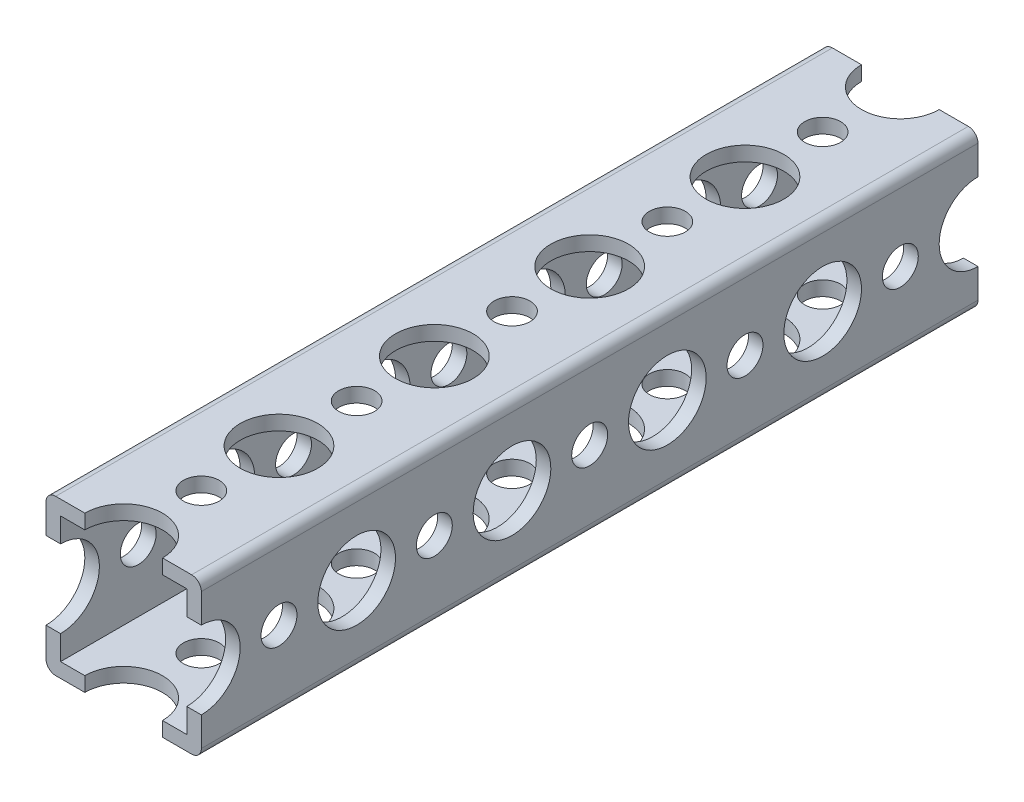
from build123d import *

# Parameters (mm, degrees)
SKETCH1_W      = 16
SKETCH1_H      = 16
EXTRUDE1_DEPTH = 80
SKETCH2_W      = 13
SKETCH2_H      = 13
EXTRUDE2_DEPTH = 84.138438763
SKETCH3_R      = 4
SKETCH3_R_2    = 1.85
EXTRUDE3_DEPTH = 84.138438763
SKETCH4_R      = 4
SKETCH4_R_2    = 1.85
EXTRUDE4_DEPTH = 84.138438763
FILLET1_R      = 1


with BuildPart() as part:
    # Sketch1 → Extrude1 (new body)
    with BuildSketch(Plane.XY):
        with Locations((8, 8)):
            Rectangle(SKETCH1_W, SKETCH1_H)
    extrude(amount=-EXTRUDE1_DEPTH)

    # Sketch2 → Extrude2 (cut, through all)
    with BuildSketch(Plane.XY):
        with Locations((8, 8)):
            Rectangle(SKETCH2_W, SKETCH2_H)
    extrude(amount=-EXTRUDE2_DEPTH, mode=Mode.SUBTRACT)

    # Sketch3 → Extrude3 (cut, through all)
    with BuildSketch(Plane(origin=(0, 16, 0), x_dir=(1, 0, 0), z_dir=(0, 1, 0))):
        with Locations(Location((8, 64, 0), (0, 0, 270))):
            Circle(SKETCH3_R)
        with Locations(Location((8, 32, 0), (0, 0, 270))):
            Circle(SKETCH3_R)
        with Locations((8, 0)):
            Circle(SKETCH3_R)
        with Locations((8, 96)):
            Circle(SKETCH3_R)
        with Locations((8, 128)):
            Circle(SKETCH3_R)
        with Locations((8, 160)):
            Circle(SKETCH3_R)
        with Locations((8, 192)):
            Circle(SKETCH3_R)
        with Locations((8, 224)):
            Circle(SKETCH3_R)
        with Locations((8, 256)):
            Circle(SKETCH3_R)
        with Locations(Location((8, 48, 0), (0, 0, 270))):
            Circle(SKETCH3_R)
        with Locations(Location((8, 56, 0), (0, 0, 270))):
            Circle(SKETCH3_R_2)
        with Locations(Location((8, 40, 0), (0, 0, 270))):
            Circle(SKETCH3_R_2)
        with Locations((8, 80)):
            Circle(SKETCH3_R)
        with Locations((8, 88)):
            Circle(SKETCH3_R_2)
        with Locations(Location((8, 72, 0), (0, 0, 270))):
            Circle(SKETCH3_R_2)
        with Locations(Location((8, 16, 0), (0, 0, 270))):
            Circle(SKETCH3_R)
        with Locations(Location((8, 24, 0), (0, 0, 270))):
            Circle(SKETCH3_R_2)
        with Locations(Location((8, 8, 0), (0, 0, 270))):
            Circle(SKETCH3_R_2)
        with Locations((8, 112)):
            Circle(SKETCH3_R)
        with Locations((8, 120)):
            Circle(SKETCH3_R_2)
        with Locations((8, 104)):
            Circle(SKETCH3_R_2)
        with Locations((8, 144)):
            Circle(SKETCH3_R)
        with Locations((8, 152)):
            Circle(SKETCH3_R_2)
        with Locations((8, 136)):
            Circle(SKETCH3_R_2)
        with Locations((8, 176)):
            Circle(SKETCH3_R)
        with Locations((8, 184)):
            Circle(SKETCH3_R_2)
        with Locations((8, 168)):
            Circle(SKETCH3_R_2)
        with Locations((8, 208)):
            Circle(SKETCH3_R)
        with Locations((8, 216)):
            Circle(SKETCH3_R_2)
        with Locations((8, 200)):
            Circle(SKETCH3_R_2)
        with Locations((8, 240)):
            Circle(SKETCH3_R)
        with Locations((8, 248)):
            Circle(SKETCH3_R_2)
        with Locations((8, 232)):
            Circle(SKETCH3_R_2)
    extrude(amount=-EXTRUDE3_DEPTH, mode=Mode.SUBTRACT)

    # Sketch4 → Extrude4 (cut, through all)
    with BuildSketch(Plane(origin=(16, 0, 0), x_dir=(0, 0, -1), z_dir=(1, 0, 0))):
        with Locations(Location((32, 8, 0), (0, 0, 90))):
            Circle(SKETCH4_R)
        with Locations(Location((64, 8, 0), (0, 0, 90))):
            Circle(SKETCH4_R)
        with Locations((0, 8)):
            Circle(SKETCH4_R)
        with Locations((96, 8)):
            Circle(SKETCH4_R)
        with Locations((128, 8)):
            Circle(SKETCH4_R)
        with Locations((160, 8)):
            Circle(SKETCH4_R)
        with Locations((192, 8)):
            Circle(SKETCH4_R)
        with Locations((224, 8)):
            Circle(SKETCH4_R)
        with Locations((256, 8)):
            Circle(SKETCH4_R)
        with Locations(Location((48, 8.074203, 0), (0, 0, 90))):
            Circle(SKETCH4_R)
        with Locations(Location((40, 8.074203, 0), (0, 0, 90))):
            Circle(SKETCH4_R_2)
        with Locations(Location((56, 8.074203, 0), (0, 0, 90))):
            Circle(SKETCH4_R_2)
        with Locations((80, 8)):
            Circle(SKETCH4_R)
        with Locations(Location((72, 8, 0), (0, 0, 90))):
            Circle(SKETCH4_R_2)
        with Locations((88, 8)):
            Circle(SKETCH4_R_2)
        with Locations(Location((16, 8, 0), (0, 0, 90))):
            Circle(SKETCH4_R)
        with Locations(Location((8, 8, 0), (0, 0, 90))):
            Circle(SKETCH4_R_2)
        with Locations(Location((24, 8, 0), (0, 0, 90))):
            Circle(SKETCH4_R_2)
        with Locations((112, 8)):
            Circle(SKETCH4_R)
        with Locations((104, 8)):
            Circle(SKETCH4_R_2)
        with Locations((120, 8)):
            Circle(SKETCH4_R_2)
        with Locations((144, 8)):
            Circle(SKETCH4_R)
        with Locations((136, 8)):
            Circle(SKETCH4_R_2)
        with Locations((152, 8)):
            Circle(SKETCH4_R_2)
        with Locations((176, 8)):
            Circle(SKETCH4_R)
        with Locations((168, 8)):
            Circle(SKETCH4_R_2)
        with Locations((184, 8)):
            Circle(SKETCH4_R_2)
        with Locations((208, 8)):
            Circle(SKETCH4_R)
        with Locations((200, 8)):
            Circle(SKETCH4_R_2)
        with Locations((216, 8)):
            Circle(SKETCH4_R_2)
        with Locations((240, 8)):
            Circle(SKETCH4_R)
        with Locations((232, 8)):
            Circle(SKETCH4_R_2)
        with Locations((248, 8)):
            Circle(SKETCH4_R_2)
    extrude(amount=-EXTRUDE4_DEPTH, mode=Mode.SUBTRACT)

    # Fillet1
    fillet1_edges = [part.edges().sort_by_distance(p)[0] for p in [
        (0, 16, -40),
        (16, 16, -40),
        (16, 0, -40),
        (0, 0, -40),
    ]]
    fillet(fillet1_edges, radius=FILLET1_R)


solid = part.part
